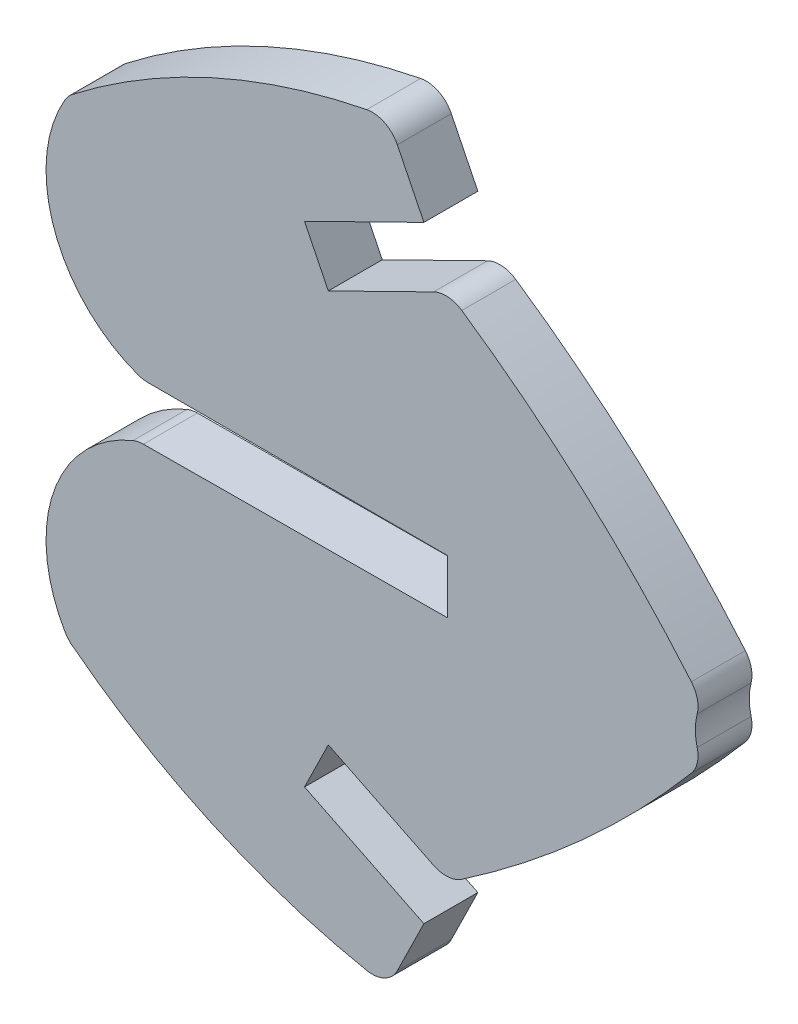
from build123d import *

# Parameters (mm, degrees)
BOSS_EXTRUDE1_DEPTH = 1.524


with BuildPart() as part:
    # Sketch1 → Boss-Extrude1 (new body)
    with BuildSketch(Plane.XY):
        with BuildLine():
            Line((73.000643508, 6.252619957), (70.027285358, 4.79070184))
            Line((70.027285358, 4.79070184), (69.354858347, 6.15833407))
            Line((69.354858347, 6.15833407), (72.727332666, 7.816486587))
            Line((72.727332666, 7.816486587), (71.978000913, 9.340533419))
            ThreePointArc((71.978000913, 9.340533419), (71.617545508, 9.701815407), (71.111637054, 9.768967549))
            ThreePointArc((71.111637054, 9.768967549), (66.728733529, 8.358005389), (62.788250891, 5.976146011))
            ThreePointArc((62.788250891, 5.976146011), (62.67763825, 5.871916038), (62.588919113, 5.748514423))
            ThreePointArc((62.588919113, 5.748514423), (62.289639081, 2.412826115), (64.660279583, 0.047144684))
            ThreePointArc((64.660279583, 0.047144684), (64.792973258, 0.011875), (64.929759758, 0))
            Line((64.929759758, 0), (73.399759676, 0))
            Line((73.399759676, 0), (73.399759676, -1.524))
            Line((73.399759676, -1.524), (64.804850415, -1.570364804))
            ThreePointArc((64.804850415, -1.570364804), (64.654260243, -1.585608721), (64.509301597, -1.629160622))
            ThreePointArc((64.509301597, -1.629160622), (62.262802552, -4.01311856), (62.588919113, -7.272514424))
            ThreePointArc((62.588919113, -7.272514424), (62.67763825, -7.395916038), (62.788250891, -7.500146011))
            ThreePointArc((62.788250891, -7.500146011), (66.728733529, -9.882005389), (71.111637054, -11.292967549))
            ThreePointArc((71.111637054, -11.292967549), (71.617545508, -11.225815407), (71.978000913, -10.864533419))
            Line((71.978000913, -10.864533419), (72.727332666, -9.340486587))
            Line((72.727332666, -9.340486587), (69.354858347, -7.68233407))
            Line((69.354858347, -7.68233407), (70.027285358, -6.31470184))
            Line((70.027285358, -6.31470184), (73.000643508, -7.776619957))
            ThreePointArc((73.000643508, -7.776619957), (73.406672693, -7.856097248), (73.797539642, -7.720452982))
            ThreePointArc((73.797539642, -7.720452982), (77.23855889, -5.019988283), (80.283555852, -1.879746802))
            ThreePointArc((80.283555852, -1.879746802), (80.451041219, -1.545581778), (80.447017019, -1.17181525))
            ThreePointArc((80.447017019, -1.17181525), (80.395843158, -0.762), (80.447017019, -0.35218475))
            ThreePointArc((80.447017019, -0.35218475), (80.451041219, 0.021581778), (80.283555852, 0.355746802))
            ThreePointArc((80.283555852, 0.355746802), (77.23855889, 3.495988283), (73.797539642, 6.196452982))
            ThreePointArc((73.797539642, 6.196452982), (73.406672693, 6.332097248), (73.000643508, 6.252619957))
        make_face()
    extrude(amount=BOSS_EXTRUDE1_DEPTH)


solid = part.part
